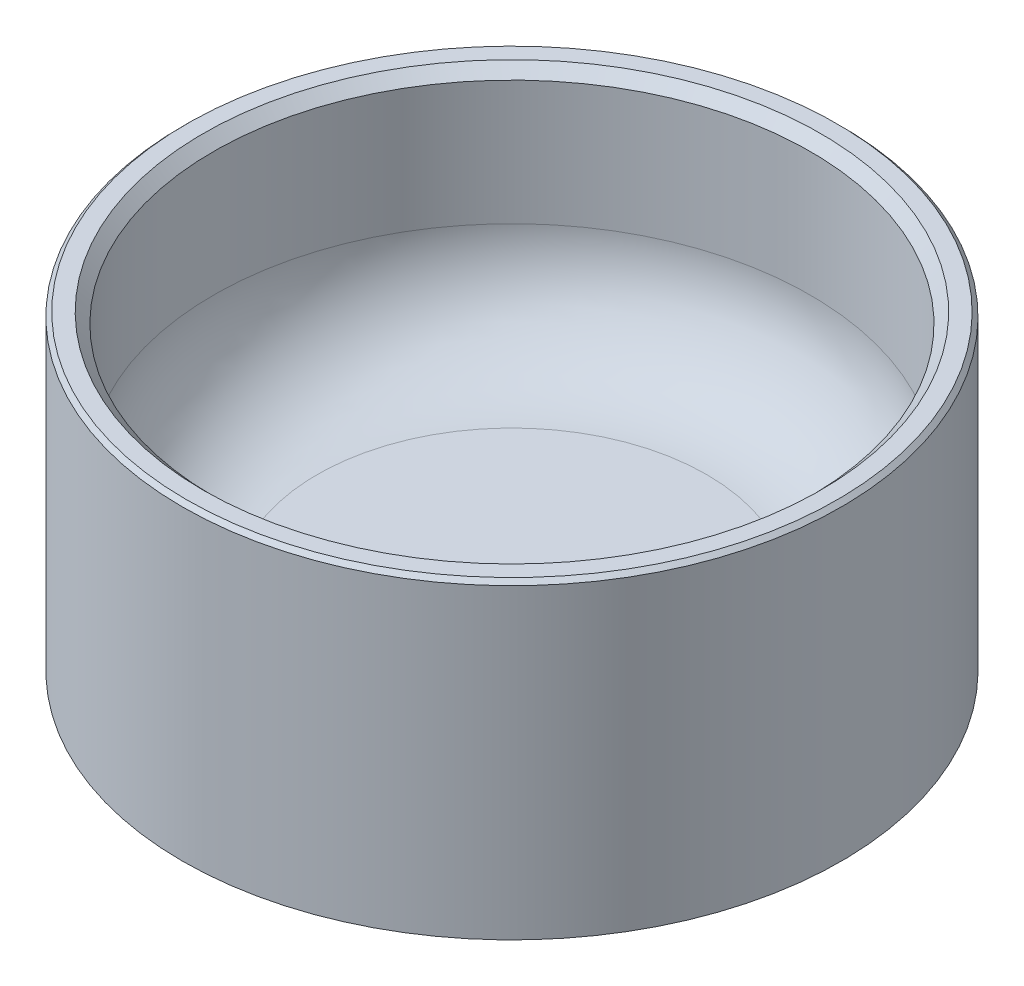
from build123d import *

# Parameters (mm, degrees)
CHAMFER1_SIZE = 0.5
CHAMFER2_SIZE = 0.2


with BuildPart() as part:
    # Sketch1 → Revolve1 (revolve)
    with BuildSketch(Plane.XY, mode=Mode.PRIVATE) as revolve1_sk:
        with BuildLine():
            Line((0, 0), (-12.4, 0))
            ThreePointArc((-12.4, 0), (-13.814213562, -0.585786438), (-14.4, -2))
            Line((-14.4, -2), (-15.9, -2))
            Line((-15.9, -2), (-15.9, 13))
            Line((-15.9, 13), (-14.4, 13))
            Line((-14.4, 13), (-14.4, 6.5))
            ThreePointArc((-14.4, 6.5), (-12.935533906, 2.964466094), (-9.4, 1.5))
            Line((-9.4, 1.5), (0, 1.5))
            Line((0, 1.5), (0, 0))
        make_face()
    revolve(revolve1_sk.sketch.rotate(Axis((0, 1.5, 0), (0, -1, 0)), 270), axis=Axis((0, 1.5, 0), (0, -1, 0)))

    # Chamfer1
    chamfer1_edges = [part.edges().sort_by_distance(p)[0] for p in [
        (0, 13, -14.4),
    ]]
    chamfer(chamfer1_edges, length=CHAMFER1_SIZE)

    # Chamfer2
    chamfer2_edges = [part.edges().sort_by_distance(p)[0] for p in [
        (0, 13, -15.9),
    ]]
    chamfer(chamfer2_edges, length=CHAMFER2_SIZE)


solid = part.part
